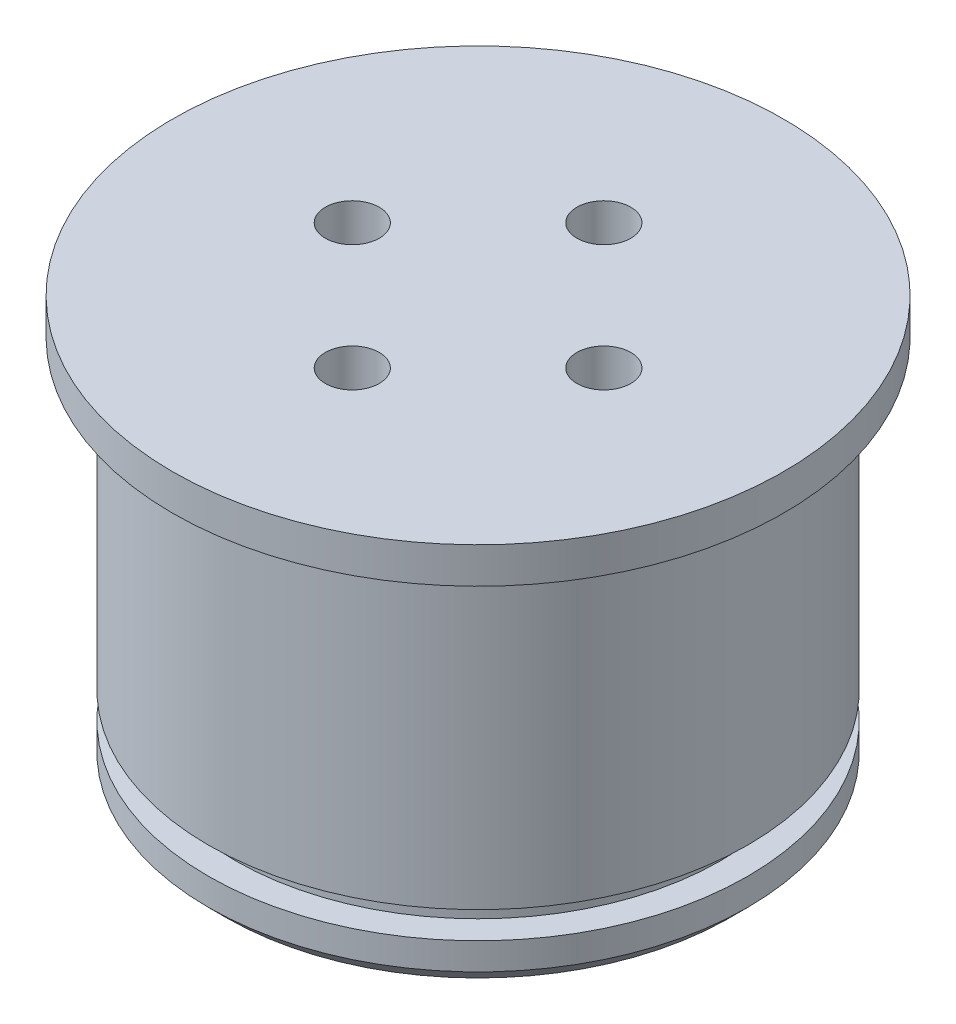
from build123d import *

# Parameters (mm, degrees)
SKETCH_1_R               = 15
EXTRUDE_1_DEPTH          = 21
SKETCH_2_R               = 10
CUT_EXTRUDE_2_DEPTH      = 2.5
SKETCH_5_R               = 15
SKETCH_5_R_2             = 13.5
CUT_EXTRUDE_5_DEPTH      = 1.5
CHAMFER_1_SIZE           = 1
SKETCH_6_R               = 17
EXTRUDE_2_DEPTH          = 2
SKETCH_4_R               = 1.5
CUT_EXTRUDE_6_DEPTH      = 32.595094556
PATTERN_CIRCULAR_1_COUNT = 4


with BuildPart() as part:
    # Эскиз1 → Бобышка-Вытянуть1 (new body)
    with BuildSketch(Plane(origin=(0, 0, 0), x_dir=(1, 0, 0), z_dir=(0, 1, 0))):
        with Locations(Location((0, 0, 0), (0, 0, 90))):
            Circle(SKETCH_1_R)
    extrude(amount=EXTRUDE_1_DEPTH)

    # Эскиз2 → Вырез-Вытянуть2 (cut)
    with BuildSketch(Plane.XZ):
        with Locations(Location((0, 0, 0), (0, 0, 270))):
            Circle(SKETCH_2_R)
    extrude(amount=-CUT_EXTRUDE_2_DEPTH, mode=Mode.SUBTRACT)

    # Эскиз5 → Вырез-Вытянуть5 (cut)
    with BuildSketch(Plane(origin=(0, 2.5, 0), x_dir=(-1, 0, 0), z_dir=(0, -1, 0))):
        with Locations(Location((0, 0, 0), (0, 0, 90))):
            Circle(SKETCH_5_R)
        with Locations(Location((0, 0, 0), (0, 0, 90))):
            Circle(SKETCH_5_R_2, mode=Mode.SUBTRACT)
    extrude(amount=-CUT_EXTRUDE_5_DEPTH, mode=Mode.SUBTRACT)

    # Фаска1
    chamfer_1_edges = [part.edges().sort_by_distance(p)[0] for p in [
        (0, 0, 15),
    ]]
    chamfer(chamfer_1_edges, length=CHAMFER_1_SIZE)

    # Эскиз6 → Бобышка-Вытянуть2 (add)
    with BuildSketch(Plane(origin=(0, 21, 0), x_dir=(1, 0, 0), z_dir=(0, 1, 0))):
        with Locations(Location((0, 0, 0), (0, 0, 270))):
            Circle(SKETCH_6_R)
    extrude(amount=EXTRUDE_2_DEPTH)

    # Эскиз4 → Вырез-Вытянуть6 (cut, through all)
    with BuildSketch(Plane.XZ.offset(-2.5)):
        with Locations(Location((0, 7, 0), (0, 0, 270))):
            Circle(SKETCH_4_R)
    cut_extrude_6 = extrude(amount=-CUT_EXTRUDE_6_DEPTH, mode=Mode.SUBTRACT)

    # Круговой массив1: Вырез-Вытянуть6 ×4 about axis
    pattern_circular_1_axis = Axis((0, 0, 0), (0, 1, 0))
    for i in range(1, PATTERN_CIRCULAR_1_COUNT):
        add(cut_extrude_6.rotate(pattern_circular_1_axis, i * 360 / PATTERN_CIRCULAR_1_COUNT), mode=Mode.SUBTRACT)


solid = part.part
